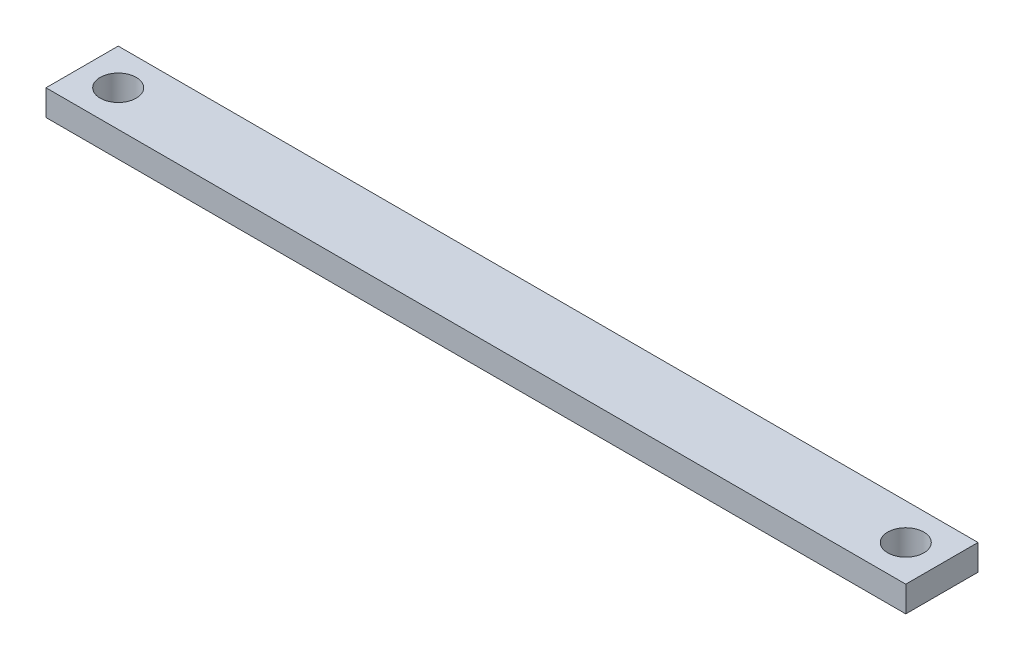
from build123d import *

# Parameters (mm, degrees)
ESQUISSE1_W             = 520
ESQUISSE1_H             = 42
BOSS_EXTRU_1_DEPTH      = 15
ESQUISSE2_R             = 10.5
ENL_V_MAT_EXTRU_1_DEPTH = 15
ESQUISSE3_W             = 10
ESQUISSE3_H             = 42
ENL_V_MAT_EXTRU_2_DEPTH = 262.277630118


with BuildPart() as part:
    # Esquisse1 → Boss.-Extru.1 (new body)
    with BuildSketch(Plane(origin=(0, 0, 0), x_dir=(1, 0, 0), z_dir=(0, 1, 0))):
        Rectangle(ESQUISSE1_W, ESQUISSE1_H)
    extrude(amount=BOSS_EXTRU_1_DEPTH)

    # Esquisse2 → Enlèv. mat.-Extru.1 (cut)
    with BuildSketch(Plane(origin=(0, 15, 0), x_dir=(1, 0, 0), z_dir=(0, 1, 0))):
        with Locations(Location((-229, 0, 0), (0, 0, 270))):
            Circle(ESQUISSE2_R)
        with Locations(Location((229, 0, 0), (0, 0, 270))):
            Circle(ESQUISSE2_R)
    extrude(amount=-ENL_V_MAT_EXTRU_1_DEPTH, mode=Mode.SUBTRACT)

    # Esquisse3 → Enlèv. mat.-Extru.2 (cut, through all)
    with BuildSketch(Plane(origin=(0, 15, 0), x_dir=(1, 0, 0), z_dir=(0, 1, 0))):
        with Locations((-255, 0)):
            Rectangle(ESQUISSE3_W, ESQUISSE3_H)
        with Locations((255, 0)):
            Rectangle(ESQUISSE3_W, ESQUISSE3_H)
    extrude(amount=-ENL_V_MAT_EXTRU_2_DEPTH, mode=Mode.SUBTRACT)


solid = part.part
